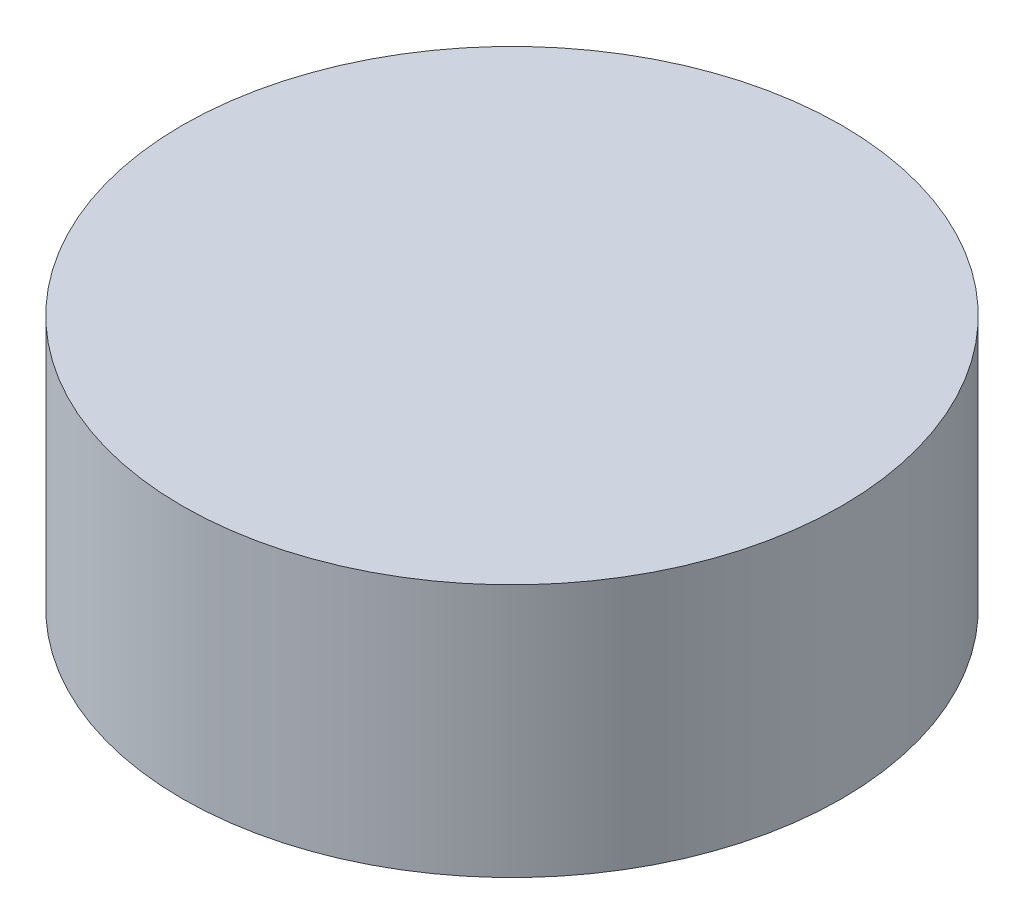
from build123d import *

# Parameters (mm, degrees)
SKETCH_1_R      = 32.25
EXTRUDE_1_DEPTH = 24.8


with BuildPart() as part:
    # 草圖1 → 填料-伸長1 (new body)
    with BuildSketch(Plane(origin=(0, 0, 0), x_dir=(1, 0, 0), z_dir=(0, 1, 0))):
        with Locations(Location((0, 0, 0), (0, 0, 90))):
            Circle(SKETCH_1_R)
    extrude(amount=EXTRUDE_1_DEPTH)


solid = part.part
